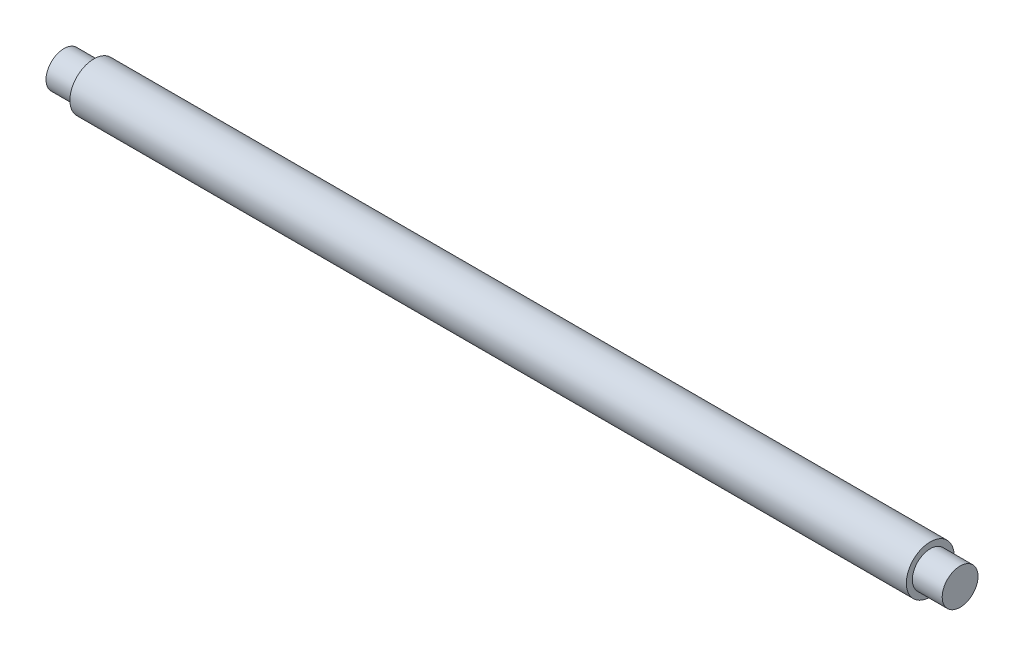
from build123d import *


with BuildPart() as part:
    # Sketch1 → Revolve1 (revolve)
    with BuildSketch(Plane(origin=(0, 0, 0), x_dir=(1, 0, 0), z_dir=(0, 1, 0)), mode=Mode.PRIVATE) as revolve1_sk:
        Polygon((-203.984063745, 0), (-203.984063745, 3), (-198.984063745, 3), (-198.984063745, 4), (-58.984063745, 4), (-58.984063745, 3), (-53.984063745, 3), (-53.984063745, 0), align=None)
    revolve(revolve1_sk.sketch.rotate(Axis((-203.984063745, 0, 0), (1, 0, 0)), 180), axis=Axis((-203.984063745, 0, 0), (1, 0, 0)))


solid = part.part
